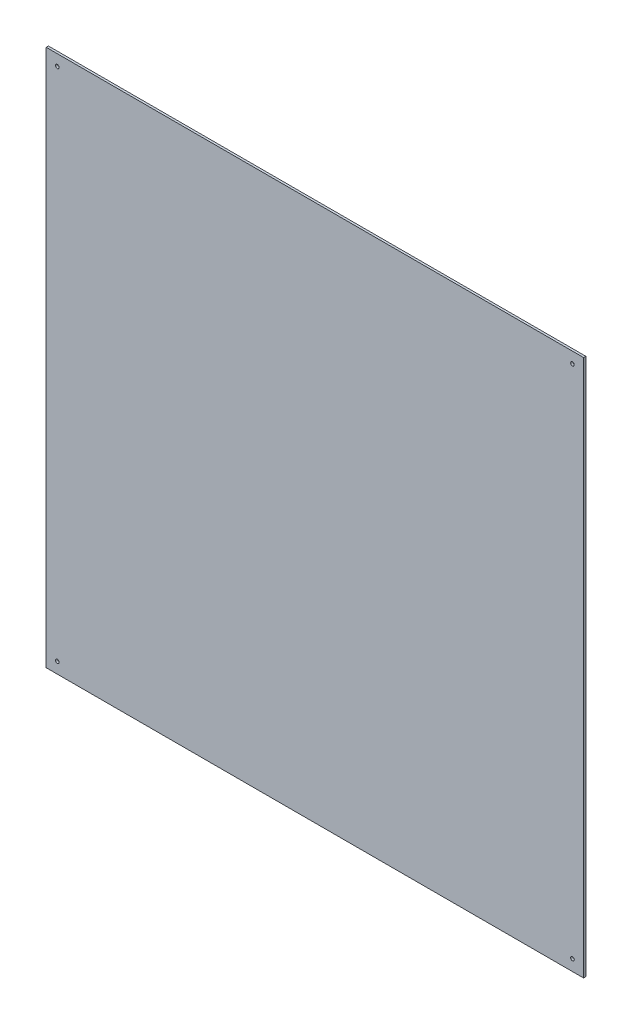
from build123d import *

# Parameters (mm, degrees)
SKETCH_1_W                  = 1210
SKETCH_1_H                  = 1210
EXTRUDE_1_DEPTH             = 5
SKETCH_2_R                  = 4.05
CUT_EXTRUDE_1_DEPTH         = 5
PATTERN_LINEAR_1_COUNT      = 2
PATTERN_LINEAR_1_PITCH      = 1160
PATTERN_LINEAR_1_COUNT_DIR2 = 2
PATTERN_LINEAR_1_PITCH_DIR2 = 1160


with BuildPart() as part:
    # 草图1 → 凸台-拉伸1 (new body)
    with BuildSketch(Plane.XY):
        Rectangle(SKETCH_1_W, SKETCH_1_H)
    extrude(amount=EXTRUDE_1_DEPTH)

    # 草图2 → 切除-拉伸1 (cut)
    with BuildSketch(Plane.XY.offset(5)):
        with Locations((580, 580)):
            Circle(SKETCH_2_R)
    cut_extrude_1 = extrude(amount=-CUT_EXTRUDE_1_DEPTH, mode=Mode.SUBTRACT)

    # 阵列(线性)1: Cut-Extrude 1 2 × 2
    with Locations(*[(-i * PATTERN_LINEAR_1_PITCH, -j * PATTERN_LINEAR_1_PITCH_DIR2, 0) for i in range(PATTERN_LINEAR_1_COUNT) for j in range(PATTERN_LINEAR_1_COUNT_DIR2) if (i, j) != (0, 0)]):
        add(cut_extrude_1, mode=Mode.SUBTRACT)


solid = part.part
